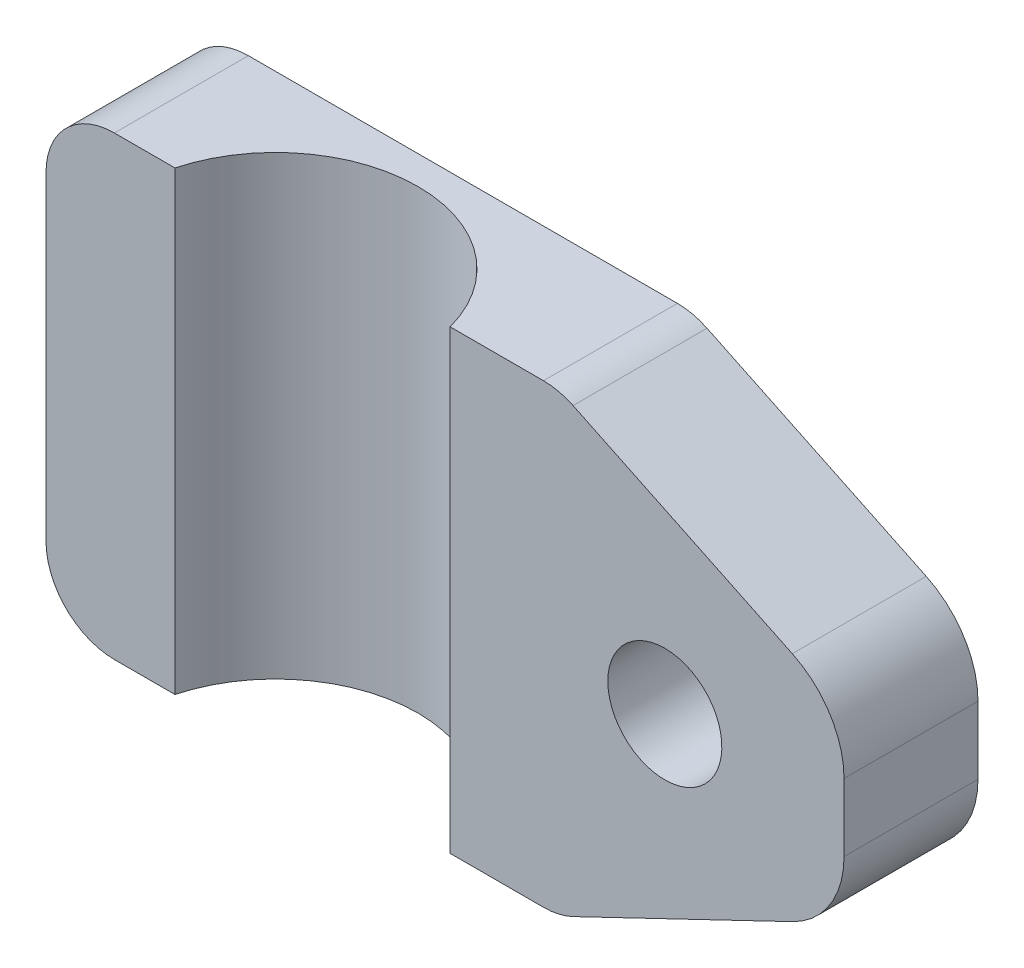
from build123d import *

# Parameters (mm, degrees)
BOSS_EXTRUDE1_DEPTH = 25
CUT_EXTRUDE2_DEPTH  = 59.736700622
SKETCH4_W           = 10
SKETCH4_H           = 40
CUT_EXTRUDE3_DEPTH  = 57.5
CUT_EXTRUDE4_DEPTH  = 1
SKETCH6_R           = 5
CUT_EXTRUDE5_DEPTH  = 44.011626335
SKETCH9_W           = 3.25
SKETCH9_H           = 40
CUT_EXTRUDE6_DEPTH  = 77.974021592


with BuildPart() as part:
    # Sketch1 → Boss-Extrude1 (new body)
    with BuildSketch(Plane.XY):
        with BuildLine():
            Line((-35, -14), (-35, 14))
            ThreePointArc((-35, 14), (-33.242640687, 18.242640687), (-29, 20))
            Line((-29, 20), (8.634575376, 20))
            ThreePointArc((8.634575376, 20), (9.965959981, 19.850420073), (11.230961782, 19.409138345))
            Line((11.230961782, 19.409138345), (30.461848541, 10.1783127))
            ThreePointArc((30.461848541, 10.1783127), (33.771070385, 7.22671574), (35, 2.966128241))
            Line((35, 2.966128241), (35, -2.966128241))
            ThreePointArc((35, -2.966128241), (33.771070385, -7.22671574), (30.461848541, -10.1783127))
            Line((30.461848541, -10.1783127), (11.230961782, -19.409138345))
            ThreePointArc((11.230961782, -19.409138345), (9.965959981, -19.850420073), (8.634575376, -20))
            Line((8.634575376, -20), (-29, -20))
            ThreePointArc((-29, -20), (-33.242640687, -18.242640687), (-35, -14))
        make_face()
    extrude(amount=BOSS_EXTRUDE1_DEPTH)

    # Sketch3 → Cut-Extrude2 (cut, through all)
    with BuildSketch(Plane(origin=(0, -20, 0), x_dir=(-1, 0, 0), z_dir=(0, -1, 0))):
        with BuildLine():
            Line((-0.88003088, -25), (24.11996912, -25))
            ThreePointArc((24.11996912, -25), (11.61996912, -12.5), (-0.88003088, -25))
        make_face()
        Polygon((11.619969205, -10), (29, -10), (29, 0), (-8.634575376, 0), (-8.634575376, -10), align=None)
    extrude(amount=-CUT_EXTRUDE2_DEPTH, mode=Mode.SUBTRACT)

    # Sketch4 → Cut-Extrude3 (cut, symmetric)
    with BuildSketch(Plane.ZY.offset(-8.634575376)):
        with Locations((5, 0)):
            Rectangle(SKETCH4_W, SKETCH4_H)
    extrude(amount=CUT_EXTRUDE3_DEPTH, both=True, mode=Mode.SUBTRACT)

    # Sketch5 → Cut-Extrude4 (cut)
    with BuildSketch(Plane(origin=(0, 0, 10), x_dir=(-1, 0, 0), z_dir=(0, 0, -1))):
        with BuildLine():
            Line((-2.634575376, -14), (26, -14))
            ThreePointArc((26, -14), (28.121320344, -13.121320344), (29, -11))
            Line((29, -11), (29, 11))
            ThreePointArc((29, 11), (28.121320344, 13.121320344), (26, 14))
            Line((26, 14), (-2.634575376, 14))
            ThreePointArc((-2.634575376, 14), (-4.75589572, 13.121320344), (-5.634575376, 11))
            Line((-5.634575376, 11), (-5.634575376, -11))
            ThreePointArc((-5.634575376, -11), (-4.75589572, -13.121320344), (-2.634575376, -14))
        make_face()
    extrude(amount=-CUT_EXTRUDE4_DEPTH, mode=Mode.SUBTRACT)

    # Sketch6 → Cut-Extrude5 (cut, through all)
    with BuildSketch(Plane(origin=(0, 0, 10), x_dir=(-1, 0, 0), z_dir=(0, 0, -1))):
        with Locations((-19.280961782, 0)):
            Circle(SKETCH6_R)
    extrude(amount=-CUT_EXTRUDE5_DEPTH, mode=Mode.SUBTRACT)

    # Sketch9 → Cut-Extrude6 (cut, through all)
    with BuildSketch(Plane.ZY.offset(35)):
        with Locations((23.375, 0)):
            Rectangle(SKETCH9_W, SKETCH9_H)
    extrude(amount=-CUT_EXTRUDE6_DEPTH, mode=Mode.SUBTRACT)


solid = part.part
